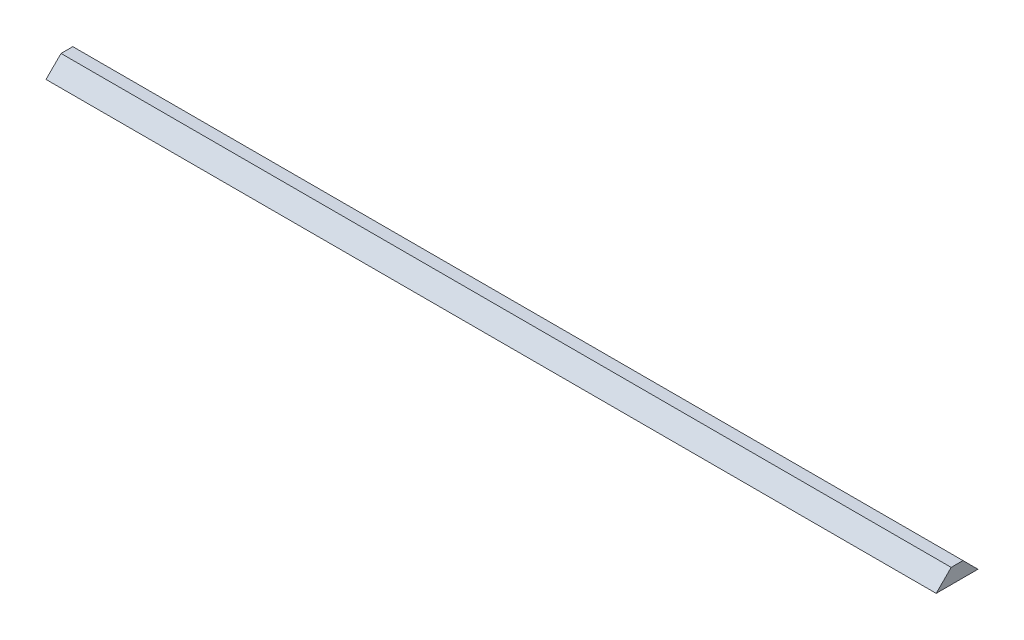
from build123d import *

# Parameters (mm, degrees)
BOSS_EXTRUDE1_DEPTH = 83


with BuildPart() as part:
    # Sketch1 → Boss-Extrude1 (new body)
    with BuildSketch(Plane(origin=(0, 0, 0), x_dir=(0, 0, -1), z_dir=(1, 0, 0))):
        Polygon((1.95, 0), (-1.95, 0), (-0.55, 1.4), (0.55, 1.4), align=None)
    extrude(amount=BOSS_EXTRUDE1_DEPTH)


solid = part.part
